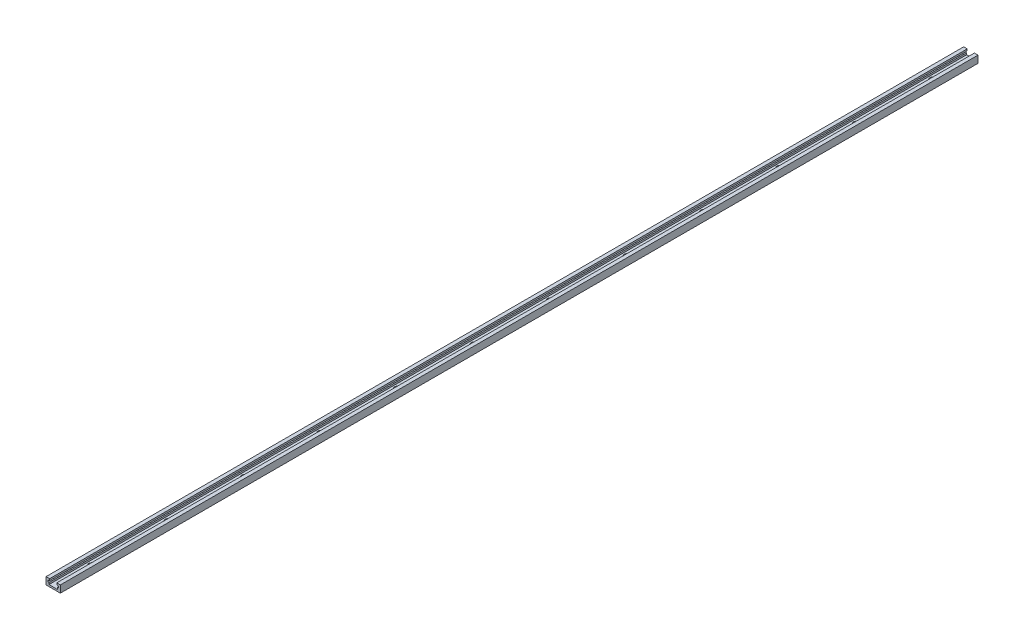
from build123d import *

# Parameters (mm, degrees)
BOSS_EXTRUDE1_DEPTH = 609.6
LPATTERN1_COUNT     = 12
LPATTERN1_PITCH     = 101.6


with BuildPart() as part:
    # Sketch1 → Boss-Extrude1 (new, symmetric)
    with BuildSketch(Plane.XY):
        Polygon((-4.7625, 0), (-9.525, 0), (-9.525, -9.525), (9.525, -9.525), (9.525, 0), (4.7625, 0), (4.7625, -2.38125), (7.14375, -2.38125), (7.14375, -4.7625), (5.55625, -4.7625), (5.55625, -7.14375), (-5.55625, -7.14375), (-5.55625, -4.7625), (-7.14375, -4.7625), (-7.14375, -2.38125), (-4.7625, -2.38125), align=None)
    extrude(amount=BOSS_EXTRUDE1_DEPTH, both=True)

    # Sketch7 → CSK for #6 Flat Head Machine Screw2 (revolve, cut)
    with BuildSketch(Plane(origin=(0, -7.14375, -558.8), x_dir=(0, 0, 1), z_dir=(1, 0, 0))):
        Polygon((0, 0), (0, 2.38125), (1.89865, 2.38125), (1.89865, 1.891953401), (3.5433, 0), align=None)
    csk_for_6_flat_head_machine_screw2 = revolve(axis=Axis((0, -0.79375, -558.8), (0, -1, 0)), mode=Mode.SUBTRACT)

    # LPattern1: CSK for #6 Flat Head Machine Screw2 ×12
    with Locations(*[(0, 0, i * LPATTERN1_PITCH) for i in range(1, LPATTERN1_COUNT)]):
        add(csk_for_6_flat_head_machine_screw2, mode=Mode.SUBTRACT)


solid = part.part
